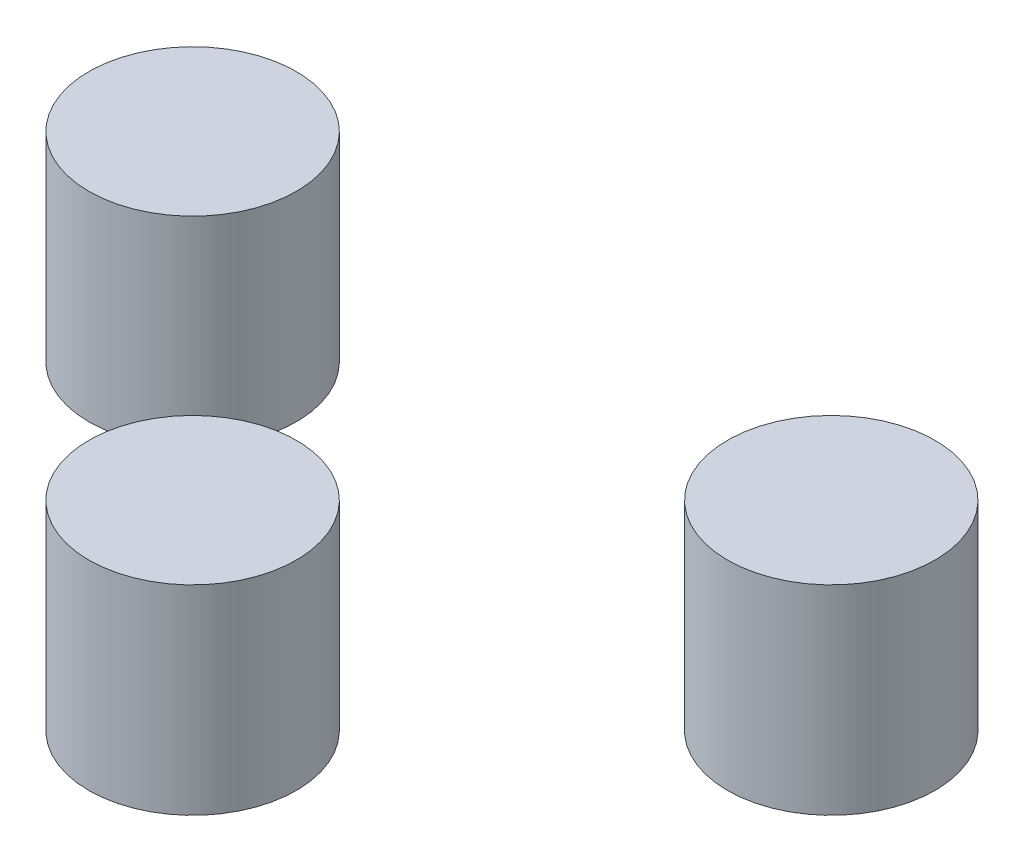
from build123d import *

# Parameters (mm, degrees)
BOSS_EXTRUDE1_START = -205
SKETCH1_R           = 130
BOSS_EXTRUDE1_DEPTH = 250
BOSS_EXTRUDE2_START = -205
SKETCH2_R           = 130
BOSS_EXTRUDE2_DEPTH = 250
BOSS_EXTRUDE3_START = -205
SKETCH3_R           = 130
BOSS_EXTRUDE3_DEPTH = 250


with BuildPart() as part:
    # Sketch1 → Boss-Extrude1 (new body)
    with BuildSketch(Plane(origin=(0, 0, 0), x_dir=(1, 0, 0), z_dir=(0, 1, 0)).offset(BOSS_EXTRUDE1_START)):
        with Locations(Location((-400, 1640, 0), (0, 0, 270))):
            Circle(SKETCH1_R)
    extrude(amount=BOSS_EXTRUDE1_DEPTH)


with BuildPart() as body_2:
    # Sketch2 → Boss-Extrude2 (new body)
    with BuildSketch(Plane(origin=(0, 0, 0), x_dir=(1, 0, 0), z_dir=(0, 1, 0)).offset(BOSS_EXTRUDE2_START)):
        with Locations(Location((400, 1640, 0), (0, 0, 270))):
            Circle(SKETCH2_R)
    extrude(amount=BOSS_EXTRUDE2_DEPTH)


with BuildPart() as body_3:
    # Sketch3 → Boss-Extrude3 (new body)
    with BuildSketch(Plane(origin=(0, 0, 0), x_dir=(1, 0, 0), z_dir=(0, 1, 0)).offset(BOSS_EXTRUDE3_START)):
        with Locations(Location((0, 1240, 0), (0, 0, 270))):
            Circle(SKETCH3_R)
    extrude(amount=BOSS_EXTRUDE3_DEPTH)


solid = Compound([part.part, body_2.part, body_3.part])
